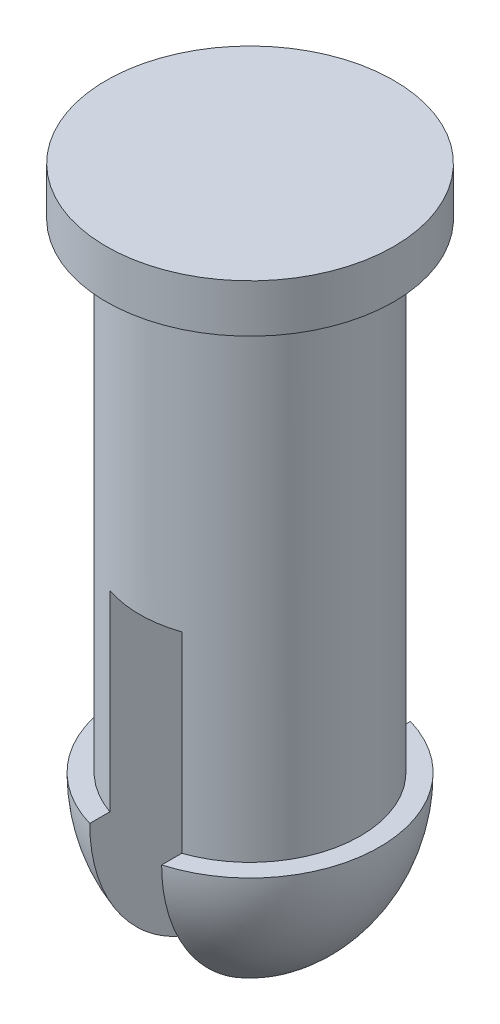
from build123d import *

# Parameters (mm, degrees)
CUT_EXTRUDE11_DEPTH = 1.27


with BuildPart() as part:
    # Sketch1 → Revolve1 (revolve)
    with BuildSketch(Plane.XY):
        with BuildLine():
            Line((0, 0), (0, 1.651))
            Line((0, 1.651), (0.381, 1.651))
            Line((0.381, 1.651), (0.381, 1.524))
            Line((0.381, 1.524), (0.2921, 1.524))
            Line((0.2921, 1.524), (0.2921, 0.254))
            Line((0.2921, 0.254), (0.3429, 0.254))
            ThreePointArc((0.3429, 0.254), (0.246747817, -0.021695325), (0, -0.1778))
            Line((0, -0.1778), (0, 0))
        make_face()
    revolve(axis=Axis((0, -1000, 0), (0, 1, 0)))

    # Sketch4 → Cut-Extrude11 (cut, symmetric)
    with BuildSketch(Plane.XY):
        Polygon((-0.09525, 0.254), (-0.09525, 0.762), (0.09525, 0.762), (0.09525, -0.3302), (-0.09525, -0.3302), align=None)
    extrude(amount=CUT_EXTRUDE11_DEPTH, both=True, mode=Mode.SUBTRACT)


solid = part.part
